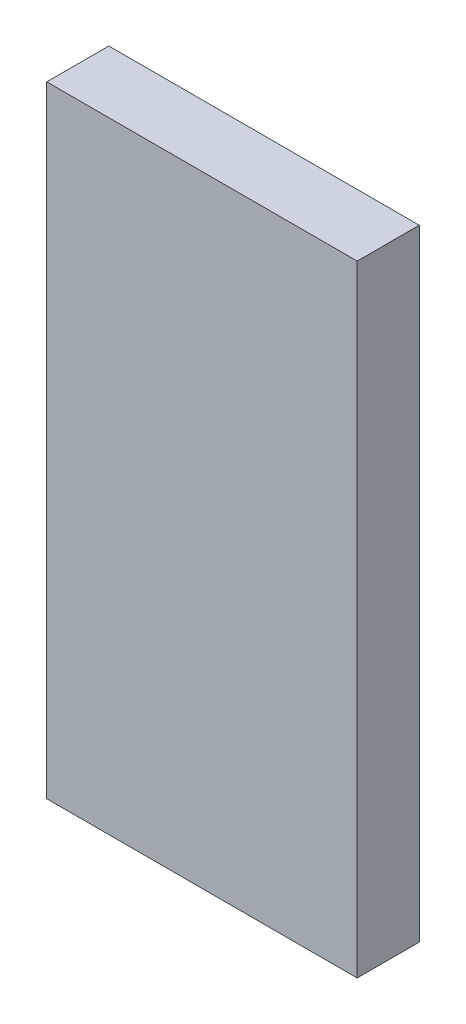
from build123d import *

# Parameters (mm, degrees)
SKETCH2_W           = 60
SKETCH2_H           = 120
BOSS_EXTRUDE1_DEPTH = 6


with BuildPart() as part:
    # Sketch2 → Boss-Extrude1 (new, symmetric)
    with BuildSketch(Plane.XY):
        Rectangle(SKETCH2_W, SKETCH2_H)
    extrude(amount=BOSS_EXTRUDE1_DEPTH, both=True)


solid = part.part
